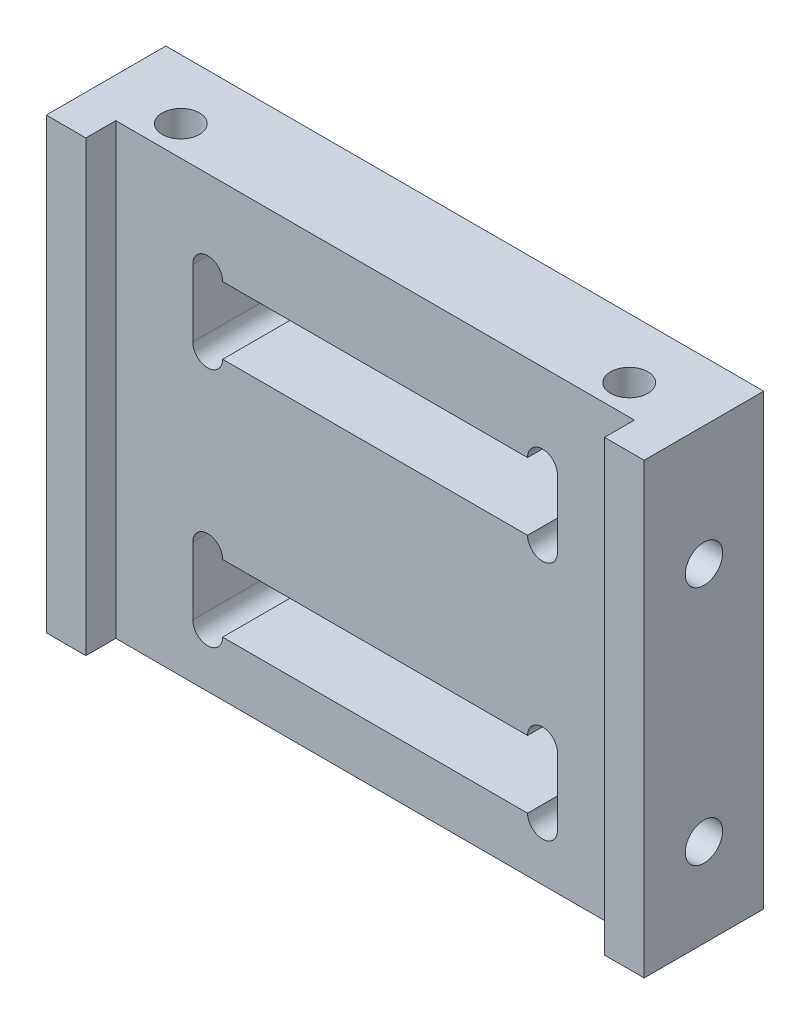
from build123d import *

# Parameters (mm, degrees)
SKETCH1_W                   = 40
SKETCH1_H                   = 30
BOSS_EXTRUDE1_DEPTH         = 4
CUT_EXTRUDE1_DEPTH          = 2
CUT_EXTRUDE2_DEPTH          = 26.709920264
M3_TAPPED_HOLE1_D           = 2.5
M3_TAPPED_HOLE1_DEPTH       = 9
M3_TAPPED_HOLE1_TIP         = 0.751075774
M3_TAPPED_HOLE2_AT_2_COUNT  = 2
M3_TAPPED_HOLE2_AT_2_PITCH  = 16.1
TAP_DRILL_FOR_M3_TAP1_D     = 2.5
TAP_DRILL_FOR_M3_TAP1_DEPTH = 4.5
TAP_DRILL_FOR_M3_TAP1_TIP   = 0.751075774


with BuildPart() as part:
    # Sketch1 → Boss-Extrude1 (new, symmetric)
    with BuildSketch(Plane.XY):
        Rectangle(SKETCH1_W, SKETCH1_H)
    extrude(amount=BOSS_EXTRUDE1_DEPTH, both=True)

    # Sketch2 → Cut-Extrude1 (cut)
    with BuildSketch(Plane.XY.offset(4)):
        with BuildLine():
            Line((-15.85, 21.25), (15.85, 21.25))
            ThreePointArc((15.85, 21.25), (16.910660172, 20.810660172), (17.35, 19.75))
            Line((17.35, 19.75), (17.35, -13.2))
            Line((17.35, -13.2), (17.35, -15))
            Line((17.35, -15), (-17.35, -15))
            Line((-17.35, -15), (-17.35, -13.2))
            Line((-17.35, -13.2), (-17.35, 19.75))
            ThreePointArc((-17.35, 19.75), (-16.910660172, 20.810660172), (-15.85, 21.25))
        make_face()
    extrude(amount=-CUT_EXTRUDE1_DEPTH, mode=Mode.SUBTRACT)

    # Sketch3 → Cut-Extrude2 (cut, through all)
    with BuildSketch(Plane.XY.offset(2)):
        with BuildLine():
            Line((12.2, 9.25), (12.2, 4.75))
            ThreePointArc((12.2, 4.75), (11.2, 3.75), (10.2, 4.75))
            Line((10.2, 4.75), (-10.2, 4.75))
            ThreePointArc((-10.2, 4.75), (-11.2, 3.75), (-12.2, 4.75))
            Line((-12.2, 4.75), (-12.2, 9.25))
            ThreePointArc((-12.2, 9.25), (-11.2, 10.25), (-10.2, 9.25))
            Line((-10.2, 9.25), (10.2, 9.25))
            ThreePointArc((10.2, 9.25), (11.2, 10.25), (12.2, 9.25))
        make_face()
        with BuildLine():
            Line((-10.2, -6.85), (10.2, -6.85))
            ThreePointArc((10.2, -6.85), (11.2, -5.85), (12.2, -6.85))
            Line((12.2, -6.85), (12.2, -11.35))
            ThreePointArc((12.2, -11.35), (11.2, -12.35), (10.2, -11.35))
            Line((10.2, -11.35), (-10.2, -11.35))
            ThreePointArc((-10.2, -11.35), (-11.2, -12.35), (-12.2, -11.35))
            Line((-12.2, -11.35), (-12.2, -6.85))
            ThreePointArc((-12.2, -6.85), (-11.2, -5.85), (-10.2, -6.85))
        make_face()
    extrude(amount=-CUT_EXTRUDE2_DEPTH, mode=Mode.SUBTRACT)

    # M3 Tapped Hole1
    with Locations(Plane(origin=(-0.662160093, -15, 0.523062075), x_dir=(1, 0, 0), z_dir=(0, -1, 0))):
        with Locations((15.162160093, -0.523062075), (-13.837839907, -0.523062075)):
            Hole(M3_TAPPED_HOLE1_D / 2, depth=M3_TAPPED_HOLE1_DEPTH)
            with Locations((0, 0, -(M3_TAPPED_HOLE1_DEPTH + M3_TAPPED_HOLE1_TIP / 2))):  # 118° drill point
                Cone(0, M3_TAPPED_HOLE1_D / 2, M3_TAPPED_HOLE1_TIP, mode=Mode.SUBTRACT)

    # Sketch16 → M3 Tapped Hole2 (revolve, cut)
    with BuildSketch(Plane(origin=(20, 7, 0), x_dir=(0, 0, -1), z_dir=(0, 1, 0))):
        Polygon((0, 0), (0, 3.751075774), (1.25, 3), (1.25, 0), align=None)
    m3_tapped_hole2 = revolve(axis=Axis((26.35, 7, 0), (-1, 0, 0)), mode=Mode.SUBTRACT)

    # M3 Tapped Hole2 at 2: M3 Tapped Hole2 ×2
    with Locations(*[(0, -i * M3_TAPPED_HOLE2_AT_2_PITCH, 0) for i in range(1, M3_TAPPED_HOLE2_AT_2_COUNT)]):
        add(m3_tapped_hole2, mode=Mode.SUBTRACT)

    # Mirror1: M3 Tapped Hole2 across plane
    add(m3_tapped_hole2.mirror(Plane(origin=(0, 0, 0), x_dir=(0, 0, 1), z_dir=(1, 0, 0))), mode=Mode.SUBTRACT)

    # Mirror1 copy 1 sketch → Mirror1 copy 1 (revolve, cut)
    with BuildSketch(Plane(origin=(-20, -9.1, 0), x_dir=(0, 0, -1), z_dir=(0, 1, 0))):
        Polygon((0, 0), (0, -3.751075774), (1.25, -3), (1.25, 0), align=None)
    revolve(axis=Axis((-26.35, -9.1, 0), (-1, 0, 0)), mode=Mode.SUBTRACT)

    # Tap Drill for M3 Tap1
    with Locations(Plane(origin=(0, 15, 0), x_dir=(1, 0, 0), z_dir=(0, 1, 0))):
        with Locations((-15, 0), (15, 0)):
            Hole(TAP_DRILL_FOR_M3_TAP1_D / 2, depth=TAP_DRILL_FOR_M3_TAP1_DEPTH)
            with Locations((0, 0, -(TAP_DRILL_FOR_M3_TAP1_DEPTH + TAP_DRILL_FOR_M3_TAP1_TIP / 2))):  # 118° drill point
                Cone(0, TAP_DRILL_FOR_M3_TAP1_D / 2, TAP_DRILL_FOR_M3_TAP1_TIP, mode=Mode.SUBTRACT)


solid = part.part
